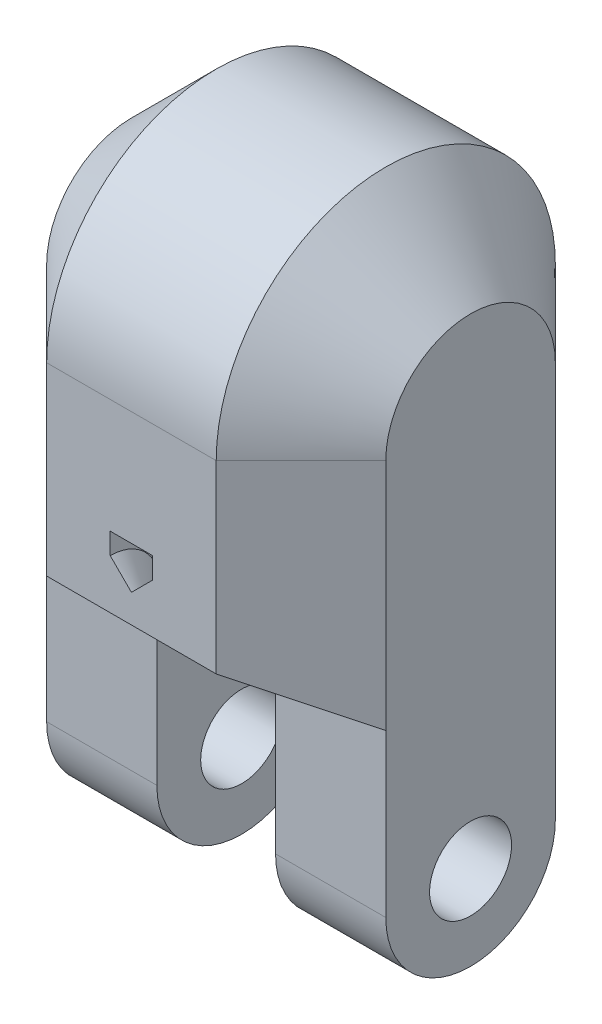
from build123d import *

# Parameters (mm, degrees)
BOSS_EXTRUDE1_DEPTH     = 5
CUT_EXTRUDE8_DEPTH      = 10.848857802
CUT_EXTRUDE8_DEPTH_BACK = 10.848857802
REVOLVE1_ANGLE          = 180
SKETCH24_W              = 3.9
SKETCH24_H              = 6
BOSS_EXTRUDE2_DEPTH     = 4
SKETCH25_W              = 3.9
SKETCH25_H              = 3
REVOLVE2_ANGLE          = 180
SKETCH26_R              = 1.45
CUT_EXTRUDE9_DEPTH      = 19
BOSS_EXTRUDE4_DEPTH     = 3.7


with BuildPart() as part:
    # Sketch2 → Boss-Extrude1 (new, symmetric)
    with BuildSketch(Plane(origin=(0, 0, 0), x_dir=(1, 0, 0), z_dir=(0, 1, 0))):
        Polygon((-3, 6), (3, 6), (6, 3), (6, -3), (3, -6), (-3, -6), (-6, -3), (-6, 3), align=None)
    extrude(amount=BOSS_EXTRUDE1_DEPTH, both=True)

    # Sketch22 → Cut-Extrude8 (cut, two sides: drawn at the far end of the back side and taken through both)
    with BuildSketch(Plane(origin=(0, 0, 0), x_dir=(0, 0, -1), z_dir=(1, 0, 0)).offset(-CUT_EXTRUDE8_DEPTH_BACK)):
        Polygon((0, -5), (-6, -5), (-6, -1.535898385), align=None)
    extrude(amount=CUT_EXTRUDE8_DEPTH + CUT_EXTRUDE8_DEPTH_BACK, mode=Mode.SUBTRACT)

    # Sketch23 → Revolve1 (revolve)
    with BuildSketch(Plane(origin=(0, 5, 0), x_dir=(1, 0, 0), z_dir=(0, 1, 0))):
        Polygon((-6, 0), (-6, 3), (-3, 6), (3, 6), (6, 3), (6, 0), align=None)
    revolve(axis=Axis((6, 5, 0), (1, 0, 0)), revolution_arc=REVOLVE1_ANGLE)

    # Sketch24 → Boss-Extrude2 (add, symmetric)
    with BuildSketch(Plane.XZ.offset(5)):
        with Locations((-4.05, 0)):
            Rectangle(SKETCH24_W, SKETCH24_H)
    boss_extrude2 = extrude(amount=BOSS_EXTRUDE2_DEPTH, both=True)

    # Sketch25 → Revolve2 (revolve)
    with BuildSketch(Plane.XZ.offset(9)):
        with Locations((-4.05, 1.5)):
            Rectangle(SKETCH25_W, SKETCH25_H)
    revolve2 = revolve(axis=Axis((-6, -9, 0), (1, 0, 0)), revolution_arc=REVOLVE2_ANGLE)

    # Sketch26 → Cut-Extrude9 (cut, symmetric)
    with BuildSketch(Plane.ZY.offset(6)):
        with Locations((0, -9)):
            Circle(SKETCH26_R)
    cut_extrude9 = extrude(amount=CUT_EXTRUDE9_DEPTH, both=True, mode=Mode.SUBTRACT)

    # Mirror1: Boss-Extrude2, Revolve2, Cut-Extrude9 across plane
    add(boss_extrude2.mirror(Plane(origin=(0, 0, 0), x_dir=(0, 0, 1), z_dir=(1, 0, 0))))
    add(revolve2.mirror(Plane(origin=(0, 0, 0), x_dir=(0, 0, 1), z_dir=(1, 0, 0))))
    add(cut_extrude9.mirror(Plane(origin=(0, 0, 0), x_dir=(0, 0, 1), z_dir=(1, 0, 0))), mode=Mode.SUBTRACT)

    # Sketch30 → Cut-Revolve1 (revolve, cut)
    with BuildSketch(Plane(origin=(0, -3.75, 2.165063509), x_dir=(1, 0, 0), z_dir=(0, -0.8660254037844418, 0.49999999999999484))):
        Polygon((0, 3.42820323), (-0.75, 2.67820323), (-0.75, 1.92820323), (0.75, 1.92820323), (0.75, 2.67820323), align=None)
    revolve(axis=Axis((-6, -1.535898385, 6), (1, 0, 0)), mode=Mode.SUBTRACT)

    # Sketch34 → Boss-Extrude4 (add)
    with BuildSketch(Plane.XZ.offset(5)):
        Polygon((-6, -3), (-2.1, -3), (2.1, -3), (6, -3), (3, -6), (-3, -6), align=None)
    extrude(amount=BOSS_EXTRUDE4_DEPTH)

    # Sketch35 → Cut-Revolve3 (revolve, cut)
    with BuildSketch(Plane.XZ.offset(8.7)):
        Polygon((0, -3.5), (-0.75, -4.25), (-0.75, -5), (0.75, -5), (0.75, -4.25), align=None)
    revolve(axis=Axis((3, -8.7, -6), (1, 0, 0)), mode=Mode.SUBTRACT)


solid = part.part
